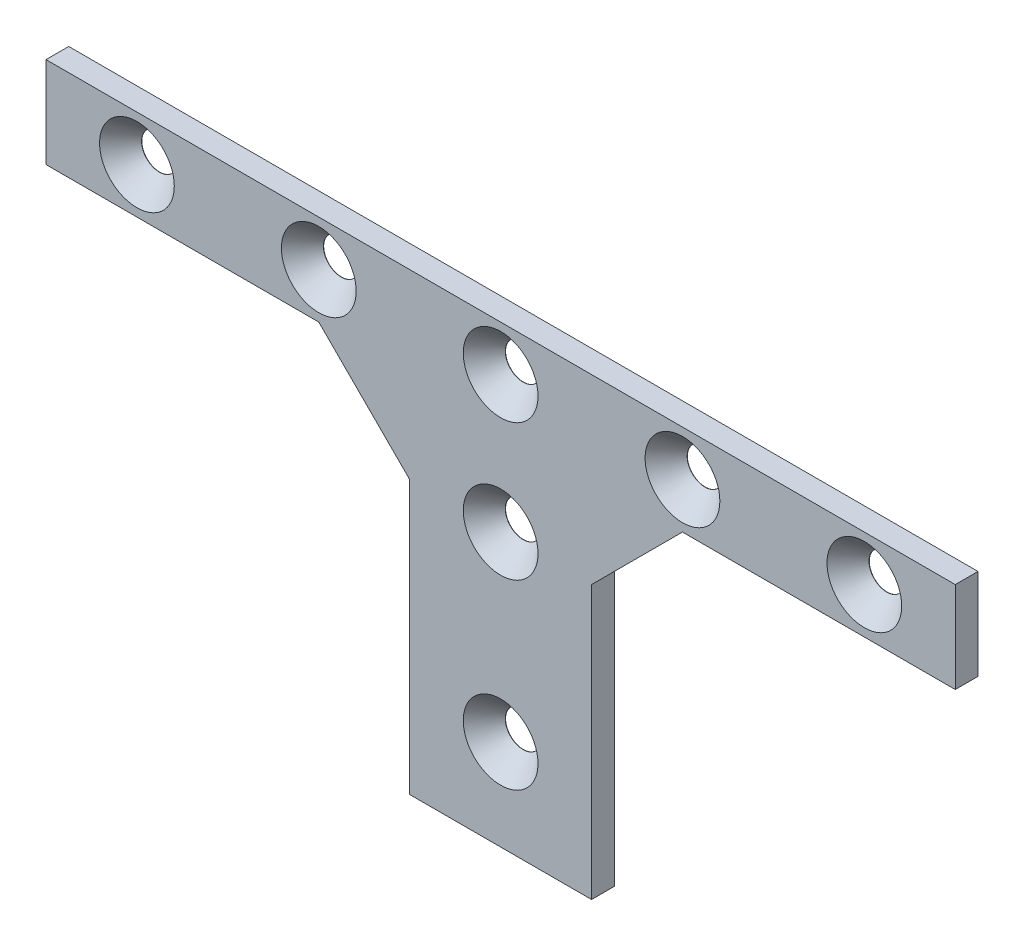
from build123d import *

# Parameters (mm, degrees)
BOSS_EXTRUDE1_DEPTH             = 3.175
F_10_CLEARANCE_HOLE1_AT_2_COUNT = 2
F_10_CLEARANCE_HOLE1_AT_2_PITCH = 25.4
F_10_CLEARANCE_HOLE1_AT_3_COUNT = 2
F_10_CLEARANCE_HOLE1_AT_3_PITCH = 50.8
F_10_CLEARANCE_HOLE1_AT_4_COUNT = 2
F_10_CLEARANCE_HOLE1_AT_4_PITCH = 101.6
F_10_CLEARANCE_HOLE1_AT_5_COUNT = 2
F_10_CLEARANCE_HOLE1_AT_5_PITCH = 54.254423783
F_10_CLEARANCE_HOLE1_AT_6_COUNT = 2
F_10_CLEARANCE_HOLE1_AT_6_PITCH = 67.501425911
F_10_CLEARANCE_HOLE1_AT_7_COUNT = 2
F_10_CLEARANCE_HOLE1_AT_7_PITCH = 76.2


with BuildPart() as part:
    # Sketch1 → Boss-Extrude1 (new body)
    with BuildSketch(Plane.XY):
        Polygon((41.275, -25.4), (41.275, -63.5), (66.675, -63.5), (66.675, -25.4), (79.375, -12.7), (117.475, -12.7), (117.475, 0), (-9.525, 0), (-9.525, -12.7), (28.575, -12.7), align=None)
    extrude(amount=BOSS_EXTRUDE1_DEPTH)

    # Sketch5 → #10 Clearance Hole1 (revolve, cut)
    with BuildSketch(Plane(origin=(3.175, -6.35, 3.175), x_dir=(0, -1, 0), z_dir=(1, 0, 0))):
        Polygon((0, 0), (0, 3.175), (2.4892, 3.175), (2.4892, 3.141080936), (5.2197, 0), align=None)
    f_10_clearance_hole1 = revolve(axis=Axis((3.175, -6.35, 9.525), (0, 0, -1)), mode=Mode.SUBTRACT)

    # #10 Clearance Hole1 at 2: #10 Clearance Hole1 ×2
    with Locations(*[(i * F_10_CLEARANCE_HOLE1_AT_2_PITCH, 0, 0) for i in range(1, F_10_CLEARANCE_HOLE1_AT_2_COUNT)]):
        add(f_10_clearance_hole1, mode=Mode.SUBTRACT)

    # #10 Clearance Hole1 at 3: #10 Clearance Hole1 ×2
    with Locations(*[(i * F_10_CLEARANCE_HOLE1_AT_3_PITCH, 0, 0) for i in range(1, F_10_CLEARANCE_HOLE1_AT_3_COUNT)]):
        add(f_10_clearance_hole1, mode=Mode.SUBTRACT)

    # #10 Clearance Hole1 at 4: #10 Clearance Hole1 ×2
    with Locations(*[(i * F_10_CLEARANCE_HOLE1_AT_4_PITCH, 0, 0) for i in range(1, F_10_CLEARANCE_HOLE1_AT_4_COUNT)]):
        add(f_10_clearance_hole1, mode=Mode.SUBTRACT)

    # #10 Clearance Hole1 at 5: #10 Clearance Hole1 ×2
    with Locations(*[Vector(0.9363291775690471, -0.35112344158838477, 0) * (i * F_10_CLEARANCE_HOLE1_AT_5_PITCH) for i in range(1, F_10_CLEARANCE_HOLE1_AT_5_COUNT)]):
        add(f_10_clearance_hole1, mode=Mode.SUBTRACT)

    # #10 Clearance Hole1 at 6: #10 Clearance Hole1 ×2
    with Locations(*[Vector(0.7525766947068834, -0.6585046078685118, 0) * (i * F_10_CLEARANCE_HOLE1_AT_6_PITCH) for i in range(1, F_10_CLEARANCE_HOLE1_AT_6_COUNT)]):
        add(f_10_clearance_hole1, mode=Mode.SUBTRACT)

    # #10 Clearance Hole1 at 7: #10 Clearance Hole1 ×2
    with Locations(*[(i * F_10_CLEARANCE_HOLE1_AT_7_PITCH, 0, 0) for i in range(1, F_10_CLEARANCE_HOLE1_AT_7_COUNT)]):
        add(f_10_clearance_hole1, mode=Mode.SUBTRACT)


solid = part.part
